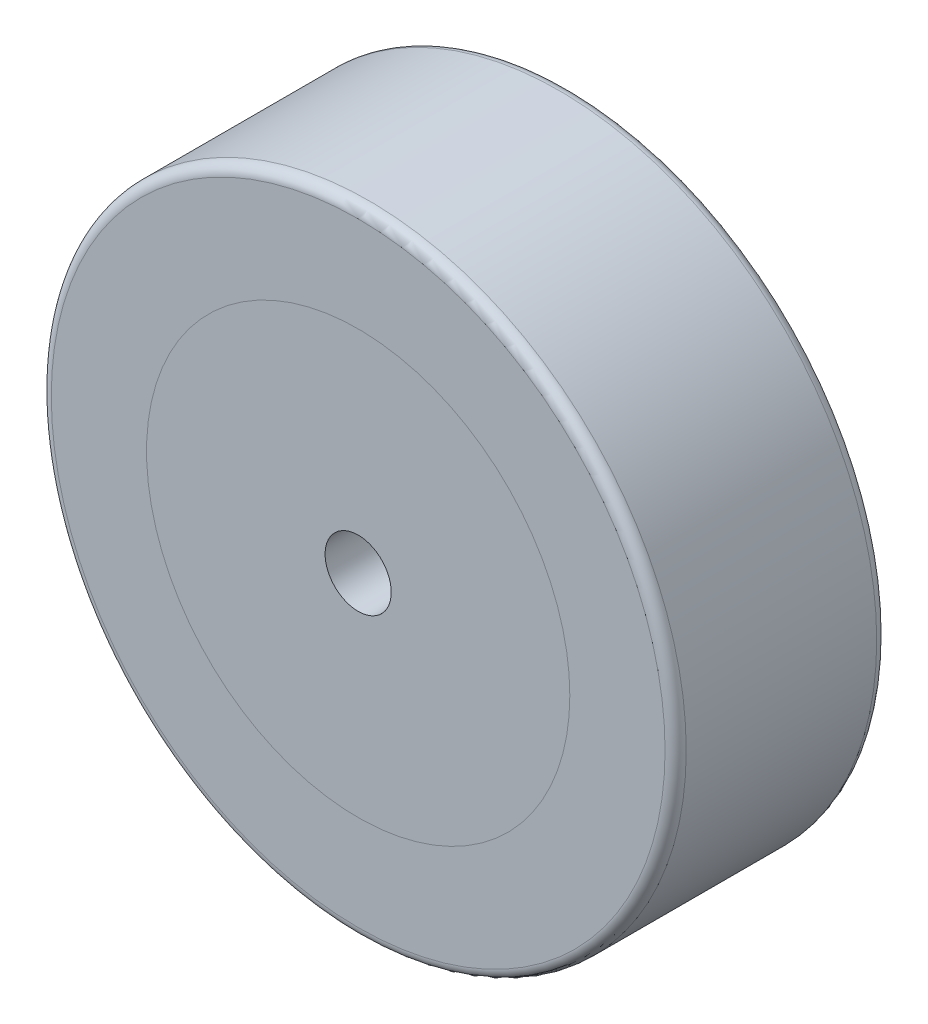
from build123d import *

# Parameters (mm, degrees)
SKETCH1_R           = 50.8
BOSS_EXTRUDE1_DEPTH = 50.8
SKETCH2_R           = 7.9375
CUT_EXTRUDE1_DEPTH  = 88.988181024
SKETCH3_R           = 76.2
SKETCH3_R_2         = 50.8
BOSS_EXTRUDE2_DEPTH = 50.8
FILLET1_R           = 2.54


with BuildPart() as part:
    # Sketch1 → Boss-Extrude1 (new body)
    with BuildSketch(Plane.XY):
        Circle(SKETCH1_R)
    extrude(amount=BOSS_EXTRUDE1_DEPTH)

    # Sketch2 → Cut-Extrude1 (cut, through all)
    with BuildSketch(Plane.XY):
        Circle(SKETCH2_R)
    extrude(amount=CUT_EXTRUDE1_DEPTH, mode=Mode.SUBTRACT)


with BuildPart() as body_2:
    # Sketch3 → Boss-Extrude2 (new body)
    with BuildSketch(Plane.XY):
        Circle(SKETCH3_R)
        Circle(SKETCH3_R_2, mode=Mode.SUBTRACT)
    extrude(amount=BOSS_EXTRUDE2_DEPTH)

    # Fillet1
    fillet1_edges = [body_2.edges().sort_by_distance(p)[0] for p in [
        (-76.2, 0, 50.8),
        (-76.2, 0, 0),
    ]]
    fillet(fillet1_edges, radius=FILLET1_R)


solid = Compound([part.part, body_2.part])
